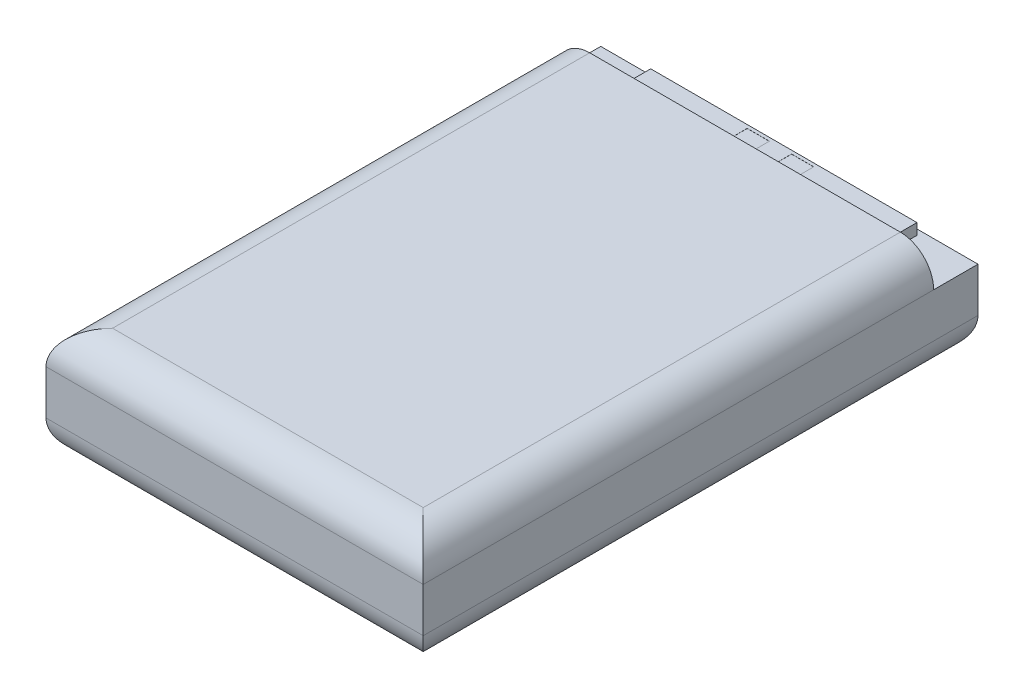
from build123d import *

# Parameters (mm, degrees)
SKETCH_1_W          = 34
SKETCH_1_H          = 50
EXTRUDE_1_DEPTH     = 10
FILLET_1_R          = 3
SKETCH_2_W          = 36
SKETCH_2_H          = 5
CUT_EXTRUDE_1_DEPTH = 3
SKETCH_3_W          = 24
SKETCH_3_H          = 3.5
EXTRUDE_2_DEPTH     = 1
SKETCH_4_W          = 2
SKETCH_4_H          = 2.9
CUT_EXTRUDE_2_DEPTH = 0.01


with BuildPart() as part:
    # Эскиз1 → Бобышка-Вытянуть1 (new body)
    with BuildSketch(Plane(origin=(0, 0, 0), x_dir=(1, 0, 0), z_dir=(0, 1, 0))):
        Rectangle(SKETCH_1_W, SKETCH_1_H)
    extrude(amount=EXTRUDE_1_DEPTH)

    # Скругление1
    fillet_1_edges = [part.edges().sort_by_distance(p)[0] for p in [
        (17, 10, 0),
        (-17, 10, 0),
        (0, 0, -25),
        (17, 0, 0),
        (0, 0, 25),
        (-17, 0, 0),
        (0, 10, 25),
    ]]
    fillet(fillet_1_edges, radius=FILLET_1_R)

    # Эскиз2 → Вырез-Вытянуть1 (cut)
    with BuildSketch(Plane(origin=(0, 10, 0), x_dir=(1, 0, 0), z_dir=(0, 1, 0))):
        with Locations((0, 23.5)):
            Rectangle(SKETCH_2_W, SKETCH_2_H)
    extrude(amount=-CUT_EXTRUDE_1_DEPTH, mode=Mode.SUBTRACT)

    # Эскиз3 → Бобышка-Вытянуть2 (add)
    with BuildSketch(Plane(origin=(0, 7, 0), x_dir=(1, 0, 0), z_dir=(0, 1, 0))):
        with Locations((0, 22.75)):
            Rectangle(SKETCH_3_W, SKETCH_3_H)
    extrude(amount=EXTRUDE_2_DEPTH)

    # Эскиз4 → Вырез-Вытянуть2 (cut)
    with BuildSketch(Plane(origin=(0, 8, 0), x_dir=(1, 0, 0), z_dir=(0, 1, 0))):
        with Locations((-2, 22.75)):
            Rectangle(SKETCH_4_W, SKETCH_4_H)
        with Locations((2, 22.75)):
            Rectangle(SKETCH_4_W, SKETCH_4_H)
    extrude(amount=-CUT_EXTRUDE_2_DEPTH, mode=Mode.SUBTRACT)


solid = part.part
